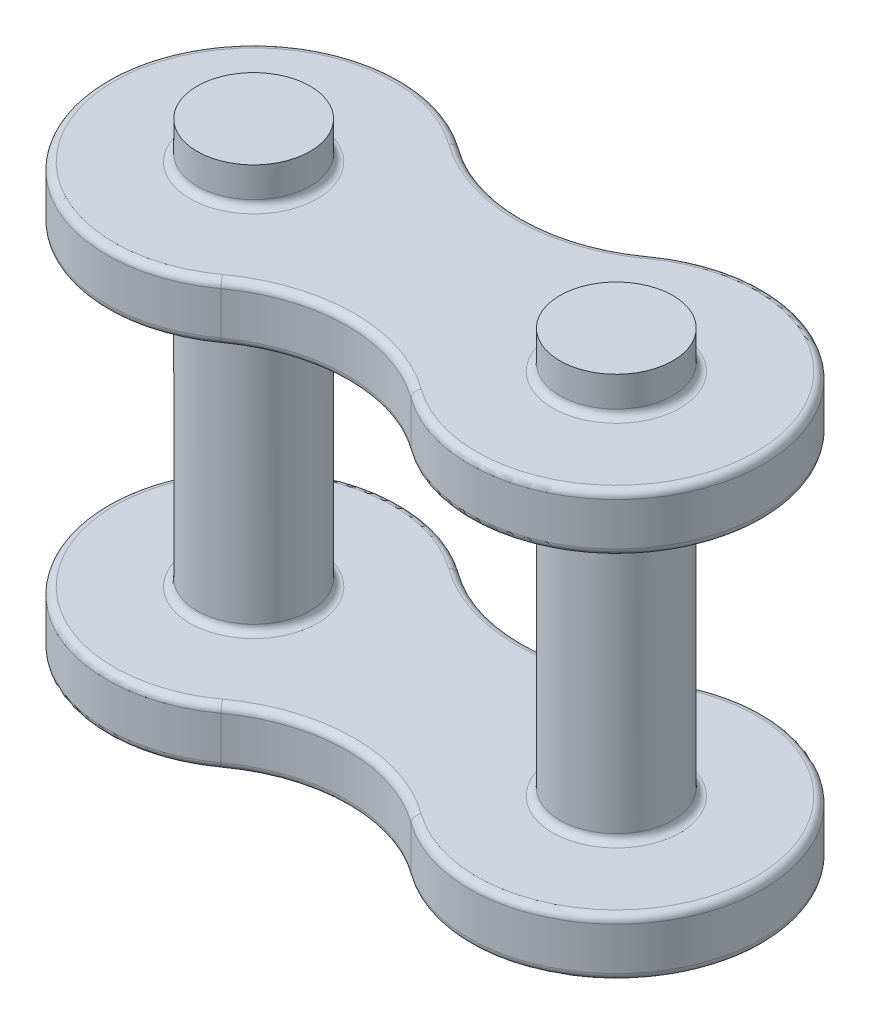
from build123d import *

# Parameters (mm, degrees)
SKETCH2_R            = 1.98
BOSS_EXTRUDE1_DEPTH  = 1.0033
SKETCH5_R            = 1.98
BOSS_EXTRUDE2_DEPTH  = 8.7503
FILLET1_R            = 0.254
FILLET1_OF_MIRROR1_R = 0.254


with BuildPart() as part:
    # Sketch2 → Boss-Extrude1 (new, symmetric)
    with BuildSketch(Plane(origin=(0, 0, 0), x_dir=(1, 0, 0), z_dir=(0, 1, 0))):
        with BuildLine():
            ThreePointArc((-3.329269201, 4.163025065), (-11.4935, 0), (-3.329269201, -4.163025065))
            ThreePointArc((-3.329269201, -4.163025065), (0, -3.082404108), (3.329269201, -4.163025065))
            ThreePointArc((3.329269201, -4.163025065), (11.4935, 0), (3.329269201, 4.163025065))
            ThreePointArc((3.329269201, 4.163025065), (0, 3.082404108), (-3.329269201, 4.163025065))
        make_face()
        with Locations(Location((-6.35, 0, 0), (0, 0, 270))):
            Circle(SKETCH2_R, mode=Mode.SUBTRACT)
        with Locations(Location((6.35, 0, 0), (0, 0, 90))):
            Circle(SKETCH2_R, mode=Mode.SUBTRACT)
    boss_extrude1 = extrude(amount=BOSS_EXTRUDE1_DEPTH, both=True)

    # Sketch5 → Boss-Extrude2 (add, symmetric)
    with BuildSketch(Plane(origin=(0, 6.4389, 0), x_dir=(1, 0, 0), z_dir=(0, 1, 0))):
        with Locations(Location((-6.35, 0, 0), (0, 0, 270))):
            Circle(SKETCH5_R)
        with Locations(Location((6.35, 0, 0), (0, 0, 90))):
            Circle(SKETCH5_R)
    extrude(amount=BOSS_EXTRUDE2_DEPTH, both=True)

    # Fillet1
    fillet1_edges = [part.edges().sort_by_distance(p)[0] for p in [
        (-6.35, 1.0033, -1.98),
        (0, 1.0033, 3.082404108),
        (6.35, 1.0033, 1.98),
        (11.4935, 1.0033, 0),
        (-6.35, -1.0033, -1.98),
        (6.35, -1.0033, 1.98),
        (0, 1.0033, -3.082404108),
        (11.4935, -1.0033, 0),
        (0, -1.0033, 3.082404108),
        (-11.4935, -1.0033, 0),
        (0, -1.0033, -3.082404108),
        (-11.4935, 1.0033, 0),
    ]]
    fillet(fillet1_edges, radius=FILLET1_R)

    # Mirror1: Boss-Extrude1 across plane
    add(boss_extrude1.mirror(Plane.ZX.offset(6.4389)))

    # Fillet1 of Mirror1
    fillet1_of_mirror1_edges = [part.edges().sort_by_distance(p)[0] for p in [
        (-6.35, 11.8745, -1.98),
        (0, 11.8745, 3.082404108),
        (6.35, 11.8745, 1.98),
        (11.4935, 11.8745, 0),
        (-6.35, 13.8811, -1.98),
        (6.35, 13.8811, 1.98),
        (0, 11.8745, -3.082404108),
        (11.4935, 13.8811, 0),
        (0, 13.8811, 3.082404108),
        (-11.4935, 13.8811, 0),
        (0, 13.8811, -3.082404108),
        (-11.4935, 11.8745, 0),
    ]]
    fillet(fillet1_of_mirror1_edges, radius=FILLET1_OF_MIRROR1_R)


solid = part.part
